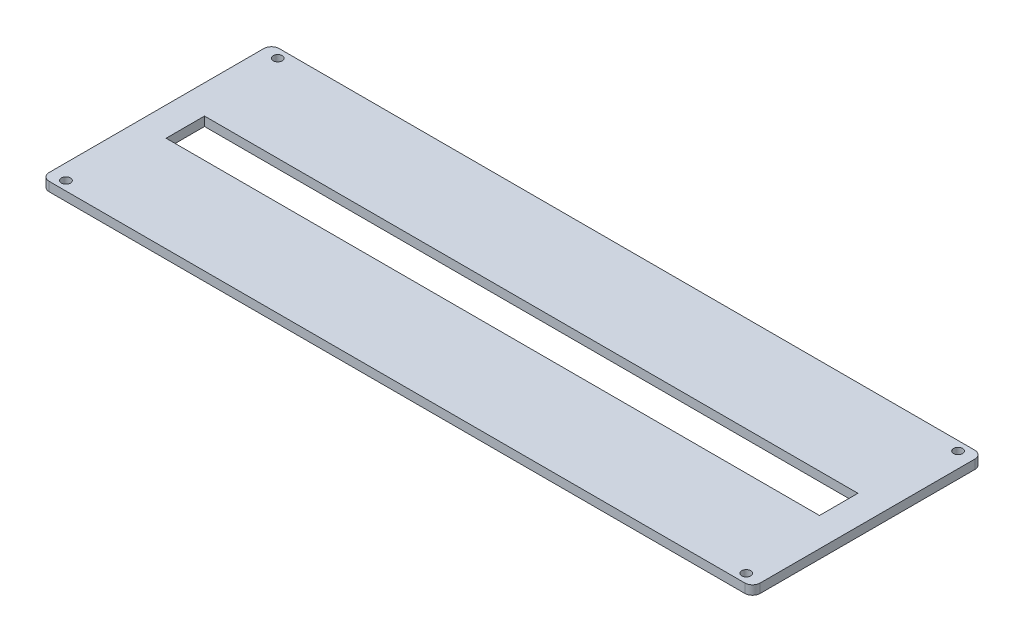
from build123d import *

# Parameters (mm, degrees)
SKETCH3_W           = 234.95
SKETCH3_H           = 76
SKETCH3_R           = 1.5
BOSS_EXTRUDE4_DEPTH = 3
SKETCH4_W           = 215.9
SKETCH4_H           = 12.7
CUT_EXTRUDE1_DEPTH  = 3.81
FILLET11_R          = 2.54


with BuildPart() as part:
    # Sketch3 → Boss-Extrude4 (new body)
    with BuildSketch(Plane(origin=(0, 0, 0), x_dir=(1, 0, 0), z_dir=(0, 1, 0))):
        with Locations((-117.475, -38)):
            Rectangle(SKETCH3_W, SKETCH3_H)
        with Locations(Location((-5.08, -3, 0), (0, 0, 270))):
            Circle(SKETCH3_R, mode=Mode.SUBTRACT)
        with Locations(Location((-5.08, -73, 0), (0, 0, 270))):
            Circle(SKETCH3_R, mode=Mode.SUBTRACT)
        with Locations(Location((-229.87, -73, 0), (0, 0, 270))):
            Circle(SKETCH3_R, mode=Mode.SUBTRACT)
        with Locations(Location((-229.87, -3, 0), (0, 0, 270))):
            Circle(SKETCH3_R, mode=Mode.SUBTRACT)
    extrude(amount=BOSS_EXTRUDE4_DEPTH)

    # Sketch4 → Cut-Extrude1 (cut)
    with BuildSketch(Plane(origin=(0, 3, 0), x_dir=(1, 0, 0), z_dir=(0, 1, 0))):
        with Locations((-117.475, -38)):
            Rectangle(SKETCH4_W, SKETCH4_H)
    extrude(amount=-CUT_EXTRUDE1_DEPTH, mode=Mode.SUBTRACT)

    # Fillet11
    fillet11_edges = [part.edges().sort_by_distance(p)[0] for p in [
        (-234.95, 1.5, 0),
        (0, 1.5, 0),
        (0, 1.5, 76),
        (-234.95, 1.5, 76),
    ]]
    fillet(fillet11_edges, radius=FILLET11_R)


solid = part.part
